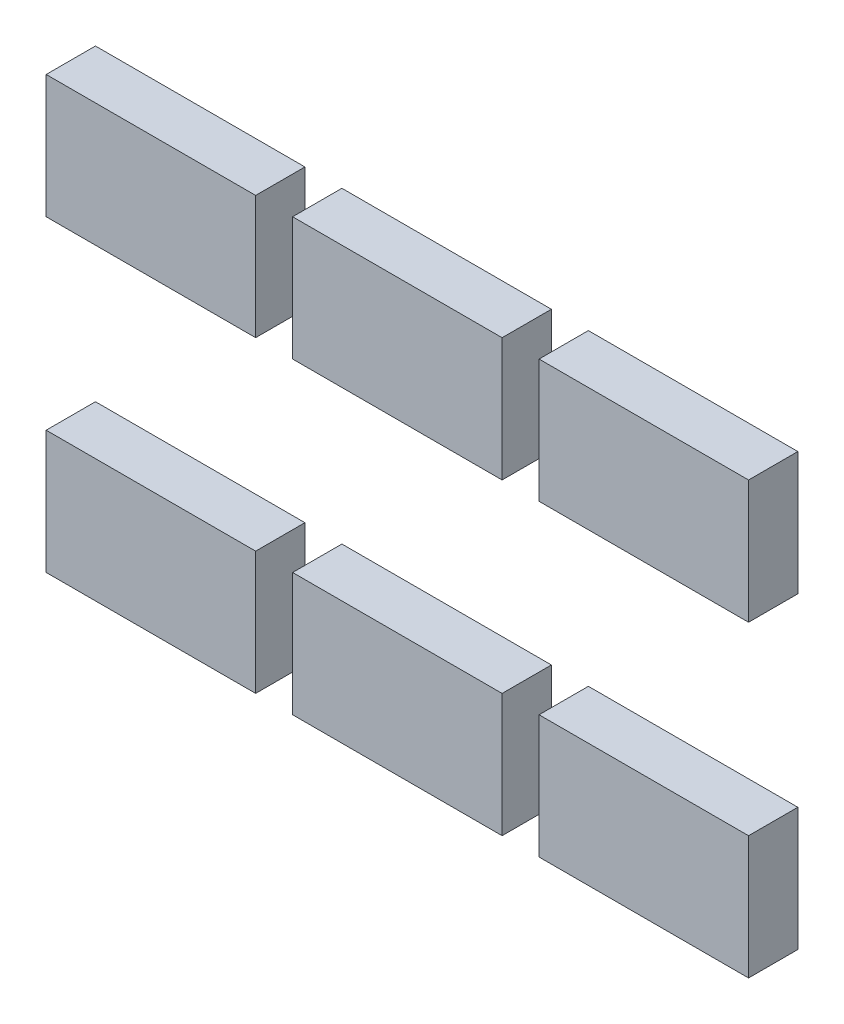
from build123d import *

# Parameters (mm, degrees)
SKETCH_1_W        = 3.4
SKETCH_1_H        = 2
EXTRUDE_1_DEPTH   = 0.8
EXTRUDE_1_2_DEPTH = 0.8
EXTRUDE_1_3_DEPTH = 0.8
EXTRUDE_1_4_DEPTH = 0.8
EXTRUDE_1_5_DEPTH = 0.8
EXTRUDE_1_6_DEPTH = 0.8


with BuildPart() as part:
    # Эскиз1 → Бобышка-Вытянуть1 (new body)
    with BuildSketch(Plane.XY):
        with Locations((4, 0)):
            Rectangle(SKETCH_1_W, SKETCH_1_H)
    extrude(amount=EXTRUDE_1_DEPTH)


with BuildPart() as body_2:
    # Эскиз1 → Extrude 1 2 (new body)
    with BuildSketch(Plane.XY):
        Rectangle(SKETCH_1_W, SKETCH_1_H)
    extrude(amount=EXTRUDE_1_2_DEPTH)


with BuildPart() as body_3:
    # Эскиз1 → Extrude 1 3 (new body)
    with BuildSketch(Plane.XY):
        with Locations((8, 0)):
            Rectangle(SKETCH_1_W, SKETCH_1_H)
    extrude(amount=EXTRUDE_1_3_DEPTH)


with BuildPart() as body_4:
    # Эскиз1 → Extrude 1 4 (new body)
    with BuildSketch(Plane.XY):
        with Locations((4, 5)):
            Rectangle(SKETCH_1_W, SKETCH_1_H)
    extrude(amount=EXTRUDE_1_4_DEPTH)


with BuildPart() as body_5:
    # Эскиз1 → Extrude 1 5 (new body)
    with BuildSketch(Plane.XY):
        with Locations((8, 5)):
            Rectangle(SKETCH_1_W, SKETCH_1_H)
    extrude(amount=EXTRUDE_1_5_DEPTH)


with BuildPart() as body_6:
    # Эскиз1 → Extrude 1 6 (new body)
    with BuildSketch(Plane.XY):
        with Locations((0, 5)):
            Rectangle(SKETCH_1_W, SKETCH_1_H)
    extrude(amount=EXTRUDE_1_6_DEPTH)


solid = Compound([part.part, body_2.part, body_3.part, body_4.part, body_5.part, body_6.part])
